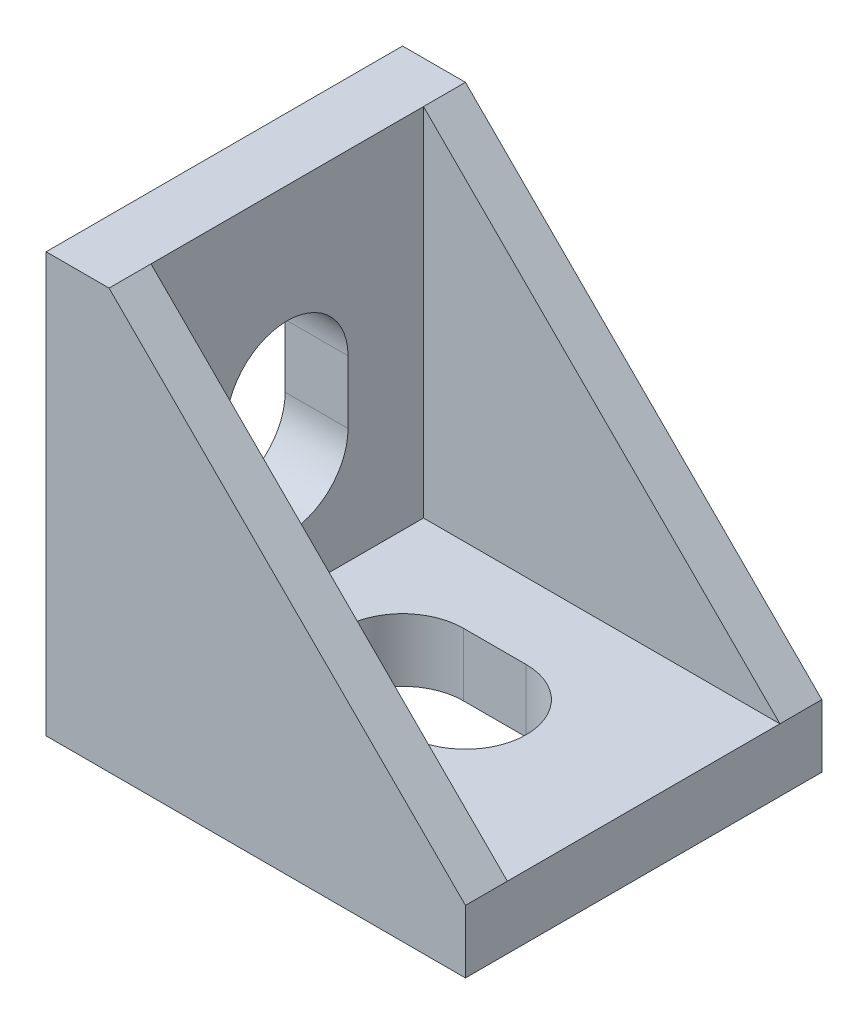
from build123d import *

# Parameters (mm, degrees)
BOSS_EXTRUDE1_DEPTH = 8.5
SKETCH2_W           = 17
SKETCH2_H           = 13
CUT_EXTRUDE1_DEPTH  = 17
CUT_EXTRUDE2_REACH  = 29.591
CUT_EXTRUDE3_DEPTH  = 28.590759323
SKETCH6_W           = 1
SKETCH6_H           = 1.85
SKETCH6_W_2         = 1.85
SKETCH6_H_2         = 1
BOSS_EXTRUDE2_DEPTH = 2


with BuildPart() as part:
    # Sketch1 → Boss-Extrude1 (new, symmetric)
    with BuildSketch(Plane.XY):
        Polygon((0, 20), (0, 0), (20, 0), (20, 3), (3, 20), align=None)
    extrude(amount=BOSS_EXTRUDE1_DEPTH, both=True)

    # Sketch2 → Cut-Extrude1 (cut)
    with BuildSketch(Plane(origin=(0, 20, 0), x_dir=(1, 0, 0), z_dir=(0, 1, 0))):
        with Locations((11.5, 0)):
            Rectangle(SKETCH2_W, SKETCH2_H)
    extrude(amount=-CUT_EXTRUDE1_DEPTH, mode=Mode.SUBTRACT)

    # Sketch3 → Cut-Extrude2 (cut, up to next)
    with BuildSketch(Plane(origin=(3, 0, 0), x_dir=(0, 0, -1), z_dir=(1, 0, 0)), mode=Mode.PRIVATE) as cut_extrude2_sk1:
        with BuildLine():
            Line((-2.9, 8.5), (-2.9, 11.5))
            ThreePointArc((-2.9, 11.5), (0, 14.4), (2.9, 11.5))
            Line((2.9, 11.5), (2.9, 8.5))
            ThreePointArc((2.9, 8.5), (0, 5.6), (-2.9, 8.5))
        make_face()
    cut_extrude2_tool1 = extrude(cut_extrude2_sk1.sketch, amount=-CUT_EXTRUDE2_REACH, mode=Mode.PRIVATE) & part.part
    add(cut_extrude2_tool1.solids().sort_by_distance((3, 10, 0))[0], mode=Mode.SUBTRACT)

    # Sketch5 → Cut-Extrude3 (cut, through all)
    with BuildSketch(Plane(origin=(0, 3, 0), x_dir=(1, 0, 0), z_dir=(0, 1, 0))):
        with BuildLine():
            Line((11.5, -2.9), (8.5, -2.9))
            ThreePointArc((8.5, -2.9), (5.6, 0), (8.5, 2.9))
            Line((8.5, 2.9), (11.5, 2.9))
            ThreePointArc((11.5, 2.9), (14.4, 0), (11.5, -2.9))
        make_face()
    extrude(amount=-CUT_EXTRUDE3_DEPTH, mode=Mode.SUBTRACT)

    # Sketch6 → Boss-Extrude2 (add, symmetric)
    with BuildSketch(Plane.XY):
        with Locations((-0.5, 17.575)):
            Rectangle(SKETCH6_W, SKETCH6_H)
        with Locations((-0.5, 2.425)):
            Rectangle(SKETCH6_W, SKETCH6_H)
        with Locations((2.425, -0.5)):
            Rectangle(SKETCH6_W_2, SKETCH6_H_2)
        with Locations((17.575, -0.5)):
            Rectangle(SKETCH6_W_2, SKETCH6_H_2)
    extrude(amount=BOSS_EXTRUDE2_DEPTH, both=True)


solid = part.part
